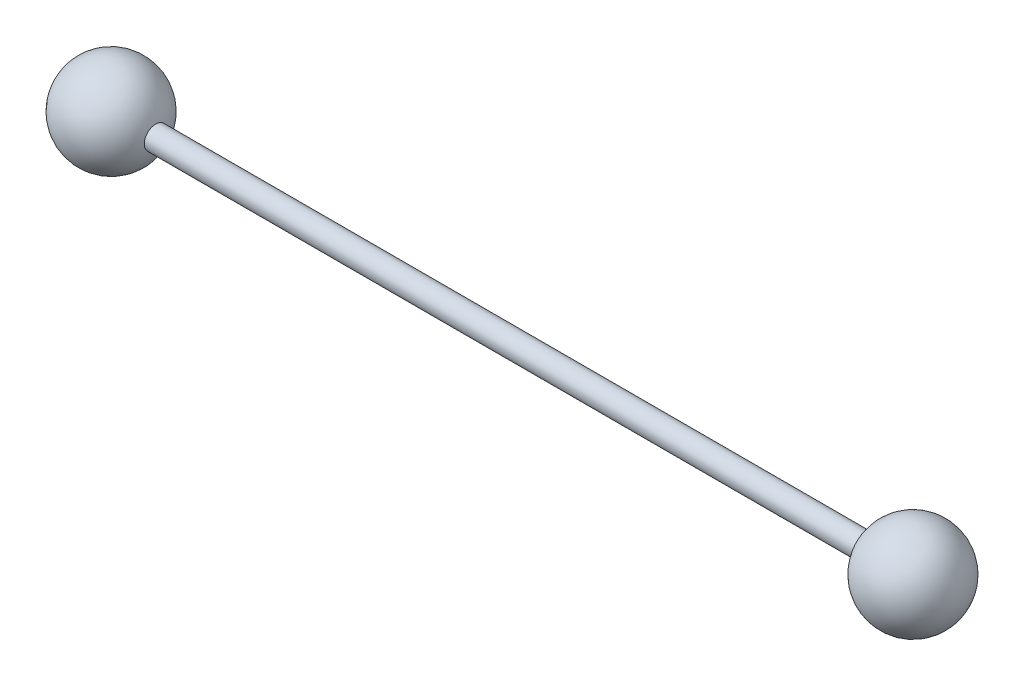
from build123d import *

# Parameters (mm, degrees)
SKETCH1_R      = 1.27
EXTRUDE1_DEPTH = 44.45


with BuildPart() as part:
    # Sketch1 → Extrude1 (new, symmetric)
    with BuildSketch(Plane(origin=(0, 0, 0), x_dir=(0, 0, -1), z_dir=(1, 0, 0))):
        Circle(SKETCH1_R)
    extrude(amount=EXTRUDE1_DEPTH, both=True)

    # Sketch2 → Revolve1 (revolve)
    with BuildSketch(Plane.ZY.offset(44.45)):
        with BuildLine():
            Line((0, -5.1054), (0, 5.1054))
            ThreePointArc((0, 5.1054), (-5.1054, 0), (0, -5.1054))
        make_face()
    revolve(axis=Axis((-44.45, 8.762723072, 0), (0, -1, 0)))

    # Sketch3 → Revolve2 (revolve)
    with BuildSketch(Plane(origin=(44.45, 0, 0), x_dir=(0, 0, -1), z_dir=(1, 0, 0))):
        with BuildLine():
            Line((0, 5.1054), (0, -5.1054))
            ThreePointArc((0, -5.1054), (5.1054, 0), (0, 5.1054))
        make_face()
    revolve(axis=Axis((44.45, 5.1054, 0), (0, -1, 0)))


solid = part.part
